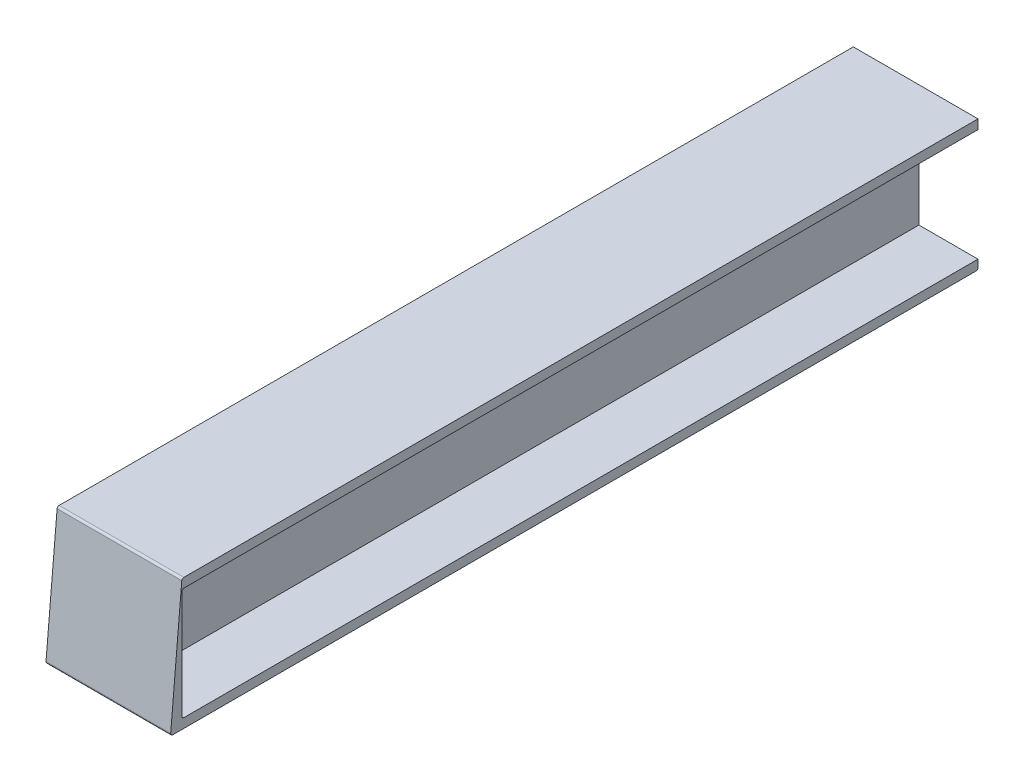
from build123d import *

# Parameters (mm, degrees)
BOSS_EXTRUDE1_DEPTH = 900
BOSS_EXTRUDE7_DEPTH = 154.432
BOSS_EXTRUDE9_DEPTH = 86.012287
FILLET1_R           = 2.54
FILLET2_R           = 2.54


with BuildPart() as part:
    # Sketch1 → Boss-Extrude1 (new body)
    with BuildSketch(Plane.XY):
        Polygon((0, -0.000240533), (154.432, -0.000240533), (154.432, -11.557240533), (81.28, -11.557240533), (81.28, -150.495240533), (154.432, -150.495240533), (154.432, -162.052240533), (0, -162.052240533), (0, -150.495240533), (73.152, -150.495240533), (73.152, -11.557240533), (0, -11.557240533), align=None)
    extrude(amount=BOSS_EXTRUDE1_DEPTH)

    # Sketch4 → Boss-Extrude7 (add)
    with BuildSketch(Plane(origin=(154.432, 0, 0), x_dir=(0, 0, -1), z_dir=(1, 0, 0))):
        Polygon((-900, -0.000240533), (-914.177712902, -162.052240533), (-900, -162.052240533), align=None)
    extrude(amount=-BOSS_EXTRUDE7_DEPTH)

    # Sketch6 → Boss-Extrude9 (add)
    with BuildSketch(Plane(origin=(0, 0, 0), x_dir=(-1, 0, 0), z_dir=(0, 0, -1))):
        Polygon((0, -11.557240533), (0, -0.000240533), (-154.432, -0.000240533), (-154.432, -11.557240533), (-81.28, -11.557240533), (-81.28, -150.495240533), (-154.432, -150.495240533), (-154.432, -162.052240533), (0, -162.052240533), (0, -150.495240533), (-73.152, -150.495240533), (-73.152, -11.557240533), align=None)
    extrude(amount=BOSS_EXTRUDE9_DEPTH)

    # Fillet1
    fillet1_edges = [part.edges().sort_by_distance(p)[0] for p in [
        (36.576, -150.495240533, 900),
        (117.856, -150.495240533, 900),
        (117.856, -11.557240533, 900),
        (77.216, -162.052240533, 914.177712902),
        (77.216, -0.000240533, 900),
        (36.576, -11.557240533, 900),
    ]]
    fillet(fillet1_edges, radius=FILLET1_R)

    # Fillet2
    fillet2_edges = [part.edges().sort_by_distance(p)[0] for p in [
        (77.216, -162.052240533, -86.012287),
    ]]
    fillet(fillet2_edges, radius=FILLET2_R)


solid = part.part
